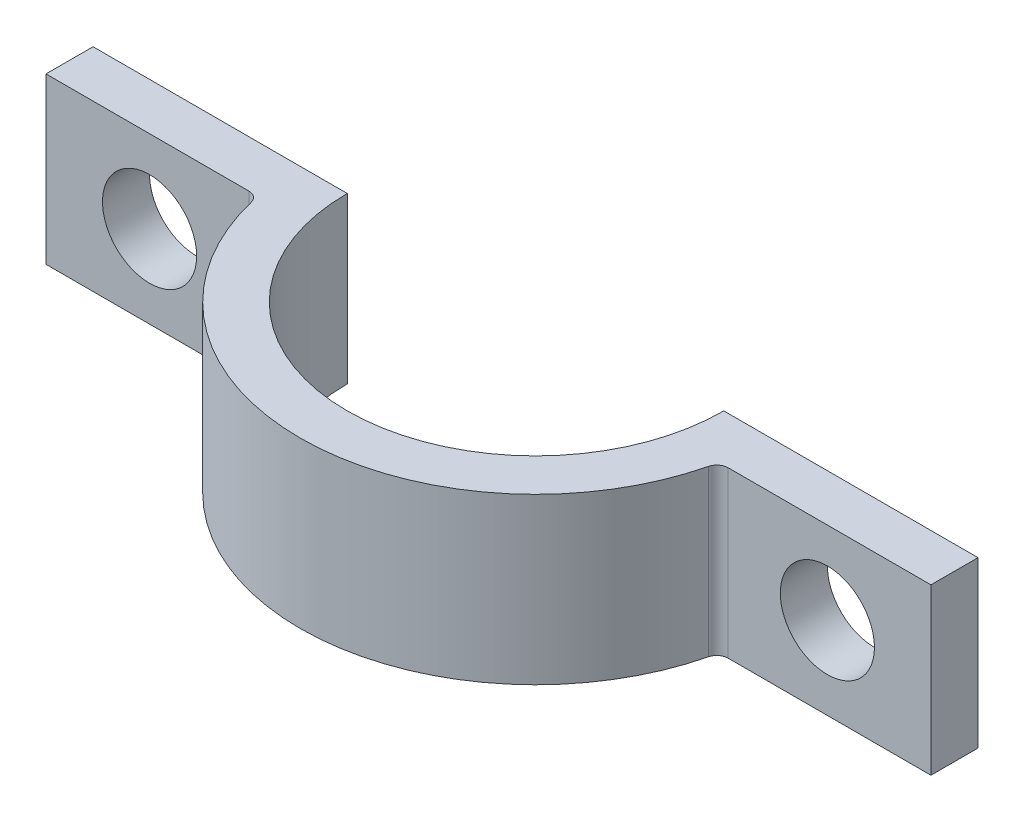
from build123d import *

# Parameters (mm, degrees)
BOSS_EXTRUDE1_DEPTH = 5.5626
SKETCH2_R           = 3.175
CUT_EXTRUDE1_DEPTH  = 33.908305088


with BuildPart() as part:
    # Sketch1 → Boss-Extrude1 (new, symmetric)
    with BuildSketch(Plane(origin=(0, 0, 0), x_dir=(1, 0, 0), z_dir=(0, 1, 0))):
        with BuildLine():
            Line((-12.7, 0), (-29.845, 0))
            Line((-29.845, 0), (-29.845, -3.175))
            Line((-29.845, -3.175), (-16.164461018, -3.175))
            ThreePointArc((-16.164461018, -3.175), (-15.693695846, -3.337813758), (-15.424104025, -3.756679389))
            ThreePointArc((-15.424104025, -3.756679389), (0, -15.875), (15.424104025, -3.756679389))
            ThreePointArc((15.424104025, -3.756679389), (15.693695846, -3.337813758), (16.164461018, -3.175))
            Line((16.164461018, -3.175), (29.845, -3.175))
            Line((29.845, -3.175), (29.845, 0))
            Line((29.845, 0), (12.7, 0))
            ThreePointArc((12.7, 0), (0, -12.7), (-12.7, 0))
        make_face()
    extrude(amount=BOSS_EXTRUDE1_DEPTH, both=True)

    # Sketch2 → Cut-Extrude1 (cut, through all)
    with BuildSketch(Plane.XY.offset(3.175)):
        with Locations((-22.86, 0)):
            Circle(SKETCH2_R)
        with Locations((22.86, 0)):
            Circle(SKETCH2_R)
    extrude(amount=-CUT_EXTRUDE1_DEPTH, mode=Mode.SUBTRACT)


solid = part.part
